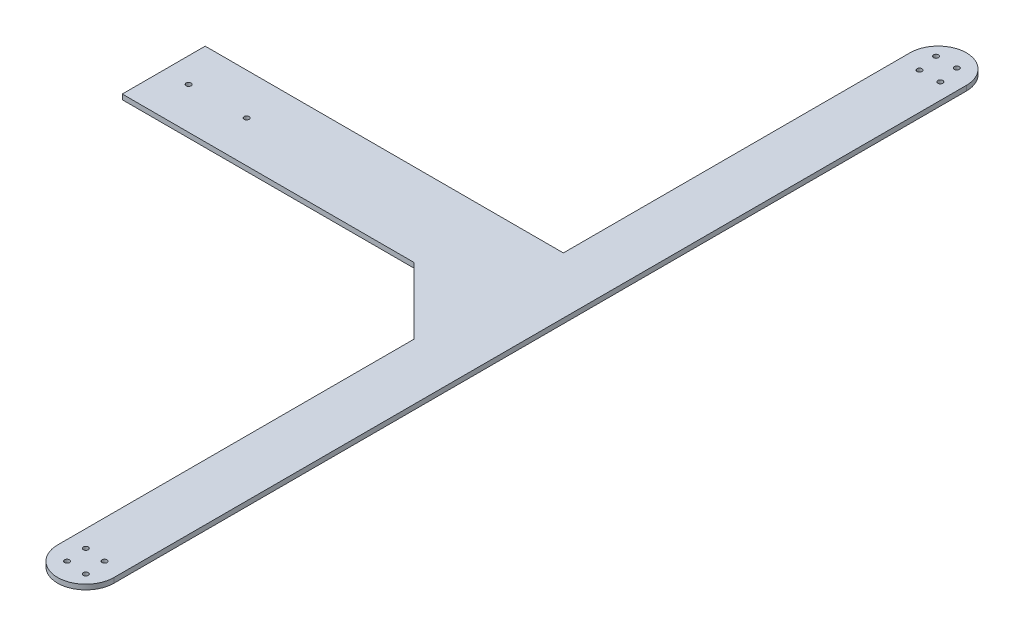
from build123d import *

# Parameters (mm, degrees)
SKETCH1_R           = 1.5
BOSS_EXTRUDE1_DEPTH = 3


with BuildPart() as part:
    # Sketch1 → Boss-Extrude1 (new body)
    with BuildSketch(Plane(origin=(0, 0, 0), x_dir=(1, 0, 0), z_dir=(0, 1, 0))):
        with BuildLine():
            Line((0, 0), (176, 0))
            Line((176, 0), (216, -40))
            Line((216, -40), (216, -255))
            ThreePointArc((216, -255), (233, -272), (250, -255))
            Line((250, -255), (250, 259.060301809))
            ThreePointArc((250, 259.060301809), (233, 276.060301809), (216, 259.060301809))
            Line((216, 259.060301809), (216, 50))
            Line((216, 50), (0, 50))
            Line((0, 50), (0, 0))
        make_face()
        with Locations(Location((238.092169369, 265.230375643, 0), (0, 0, 270))):
            Circle(SKETCH1_R, mode=Mode.SUBTRACT)
        with Locations(Location((225.673037322, 265.107252935, 0), (0, 0, 270))):
            Circle(SKETCH1_R, mode=Mode.SUBTRACT)
        with Locations(Location((227.907830631, 252.890227975, 0), (0, 0, 270))):
            Circle(SKETCH1_R, mode=Mode.SUBTRACT)
        with Locations(Location((240.326962678, 253.013350683, 0), (0, 0, 270))):
            Circle(SKETCH1_R, mode=Mode.SUBTRACT)
        with Locations(Location((226.282485579, -248.282485579, 0), (0, 0, 270))):
            Circle(SKETCH1_R, mode=Mode.SUBTRACT)
        with Locations(Location((238.656854249, -249.343145751, 0), (0, 0, 270))):
            Circle(SKETCH1_R, mode=Mode.SUBTRACT)
        with Locations(Location((239.717514421, -261.717514421, 0), (0, 0, 270))):
            Circle(SKETCH1_R, mode=Mode.SUBTRACT)
        with Locations(Location((227.343145751, -260.656854249, 0), (0, 0, 270))):
            Circle(SKETCH1_R, mode=Mode.SUBTRACT)
        with Locations(Location((15, 25, 0), (0, 0, 270))):
            Circle(SKETCH1_R, mode=Mode.SUBTRACT)
        with Locations(Location((50, 25, 0), (0, 0, 270))):
            Circle(SKETCH1_R, mode=Mode.SUBTRACT)
    extrude(amount=BOSS_EXTRUDE1_DEPTH)


solid = part.part
